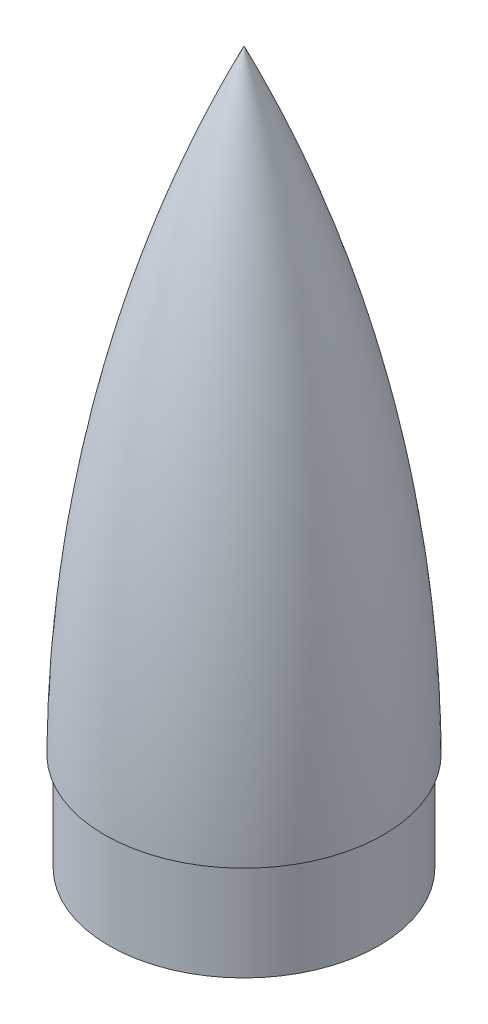
from build123d import *


with BuildPart() as part:
    # Croquis1 → Revolución1 (revolve)
    with BuildSketch(Plane(origin=(0, 0, 0), x_dir=(0, 0, -1), z_dir=(1, 0, 0))):
        with BuildLine():
            Line((50, 12), (50, 103.234638666))
            ThreePointArc((50, 103.234638666), (32.109347109, 195.035557404), (0, 282.879020282))
            Line((0, 282.879020282), (0, 290))
            ThreePointArc((0, 290), (42.008882213, 168.091938039), (56.8, 40))
            Line((56.8, 40), (55, 40))
            Line((55, 40), (55, 0))
            Line((55, 0), (50, 0))
            Line((50, 0), (0, 0))
            Line((0, 0), (0, 12))
            Line((0, 12), (50, 12))
        make_face()
    revolve(axis=Axis((0, 0, 0), (0, 1, 0)))


solid = part.part
